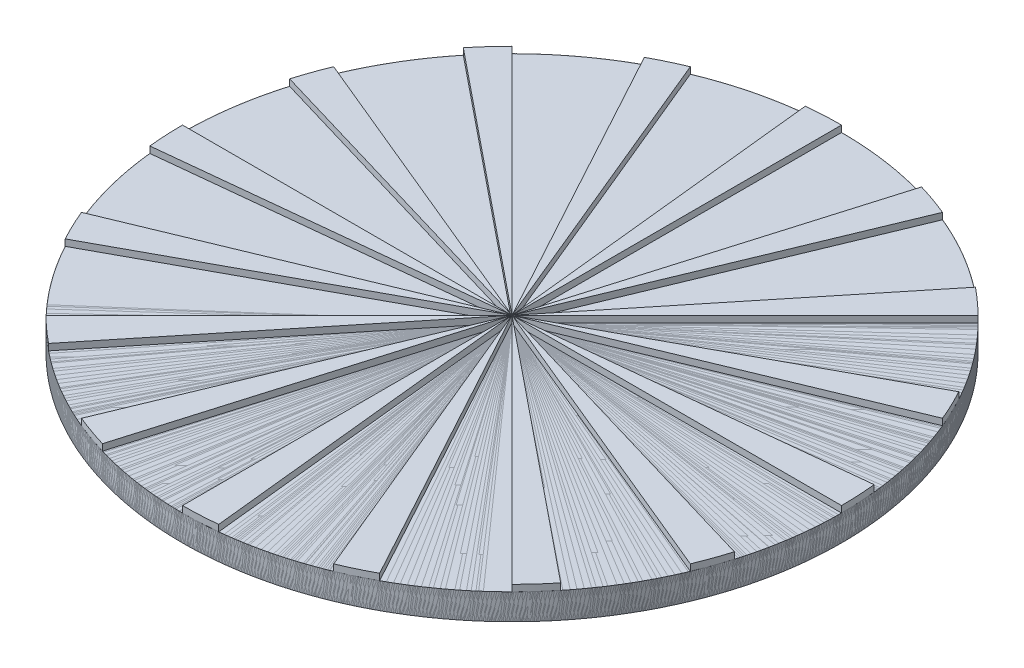
from build123d import *

# Parameters (mm, degrees)
SKETCH1_R           = 152.4
BOSS_EXTRUDE1_DEPTH = 11.9888
BOSS_EXTRUDE2_DEPTH = 2.9972
CIRPATTERN3_COUNT   = 16


with BuildPart() as part:
    # Sketch1 → Boss-Extrude1 (new body)
    with BuildSketch(Plane(origin=(0, 0, 0), x_dir=(1, 0, 0), z_dir=(0, 1, 0))):
        Circle(SKETCH1_R)
    extrude(amount=BOSS_EXTRUDE1_DEPTH)

    # Sketch2 → Boss-Extrude2 (add)
    with BuildSketch(Plane(origin=(0, 11.9888, 0), x_dir=(1, 0, 0), z_dir=(0, 1, 0))):
        with BuildLine():
            Line((151.565136854, 15.930137802), (0, 0))
            Line((0, 0), (152.4, 0))
            ThreePointArc((152.4, 0), (152.191141097, 7.975999731), (151.565136854, 15.930137802))
        make_face()
    extrude(amount=BOSS_EXTRUDE2_DEPTH)


with BuildPart() as cirpattern3_1:
    # CirPattern3: pattern copy
    add(part.part.rotate(Axis((0, 11.9888, 0), (0, 1, 0)), 1 * 360 / CIRPATTERN3_COUNT))


with BuildPart() as cirpattern3_2:
    # CirPattern3: pattern copy
    add(part.part.rotate(Axis((0, 11.9888, 0), (0, 1, 0)), 2 * 360 / CIRPATTERN3_COUNT))


with BuildPart() as cirpattern3_3:
    # CirPattern3: pattern copy
    add(part.part.rotate(Axis((0, 11.9888, 0), (0, 1, 0)), 3 * 360 / CIRPATTERN3_COUNT))


with BuildPart() as cirpattern3_4:
    # CirPattern3: pattern copy
    add(part.part.rotate(Axis((0, 11.9888, 0), (0, 1, 0)), 4 * 360 / CIRPATTERN3_COUNT))


with BuildPart() as cirpattern3_5:
    # CirPattern3: pattern copy
    add(part.part.rotate(Axis((0, 11.9888, 0), (0, 1, 0)), 5 * 360 / CIRPATTERN3_COUNT))


with BuildPart() as cirpattern3_6:
    # CirPattern3: pattern copy
    add(part.part.rotate(Axis((0, 11.9888, 0), (0, 1, 0)), 6 * 360 / CIRPATTERN3_COUNT))


with BuildPart() as cirpattern3_7:
    # CirPattern3: pattern copy
    add(part.part.rotate(Axis((0, 11.9888, 0), (0, 1, 0)), 7 * 360 / CIRPATTERN3_COUNT))


with BuildPart() as cirpattern3_8:
    # CirPattern3: pattern copy
    add(part.part.rotate(Axis((0, 11.9888, 0), (0, 1, 0)), 8 * 360 / CIRPATTERN3_COUNT))


with BuildPart() as cirpattern3_9:
    # CirPattern3: pattern copy
    add(part.part.rotate(Axis((0, 11.9888, 0), (0, 1, 0)), 9 * 360 / CIRPATTERN3_COUNT))


with BuildPart() as cirpattern3_10:
    # CirPattern3: pattern copy
    add(part.part.rotate(Axis((0, 11.9888, 0), (0, 1, 0)), 10 * 360 / CIRPATTERN3_COUNT))


with BuildPart() as cirpattern3_11:
    # CirPattern3: pattern copy
    add(part.part.rotate(Axis((0, 11.9888, 0), (0, 1, 0)), 11 * 360 / CIRPATTERN3_COUNT))


with BuildPart() as cirpattern3_12:
    # CirPattern3: pattern copy
    add(part.part.rotate(Axis((0, 11.9888, 0), (0, 1, 0)), 12 * 360 / CIRPATTERN3_COUNT))


with BuildPart() as cirpattern3_13:
    # CirPattern3: pattern copy
    add(part.part.rotate(Axis((0, 11.9888, 0), (0, 1, 0)), 13 * 360 / CIRPATTERN3_COUNT))


with BuildPart() as cirpattern3_14:
    # CirPattern3: pattern copy
    add(part.part.rotate(Axis((0, 11.9888, 0), (0, 1, 0)), 14 * 360 / CIRPATTERN3_COUNT))


with BuildPart() as cirpattern3_15:
    # CirPattern3: pattern copy
    add(part.part.rotate(Axis((0, 11.9888, 0), (0, 1, 0)), 15 * 360 / CIRPATTERN3_COUNT))


solid = Compound([part.part, cirpattern3_1.part, cirpattern3_2.part, cirpattern3_3.part, cirpattern3_4.part, cirpattern3_5.part, cirpattern3_6.part, cirpattern3_7.part, cirpattern3_8.part, cirpattern3_9.part, cirpattern3_10.part, cirpattern3_11.part, cirpattern3_12.part, cirpattern3_13.part, cirpattern3_14.part, cirpattern3_15.part])
